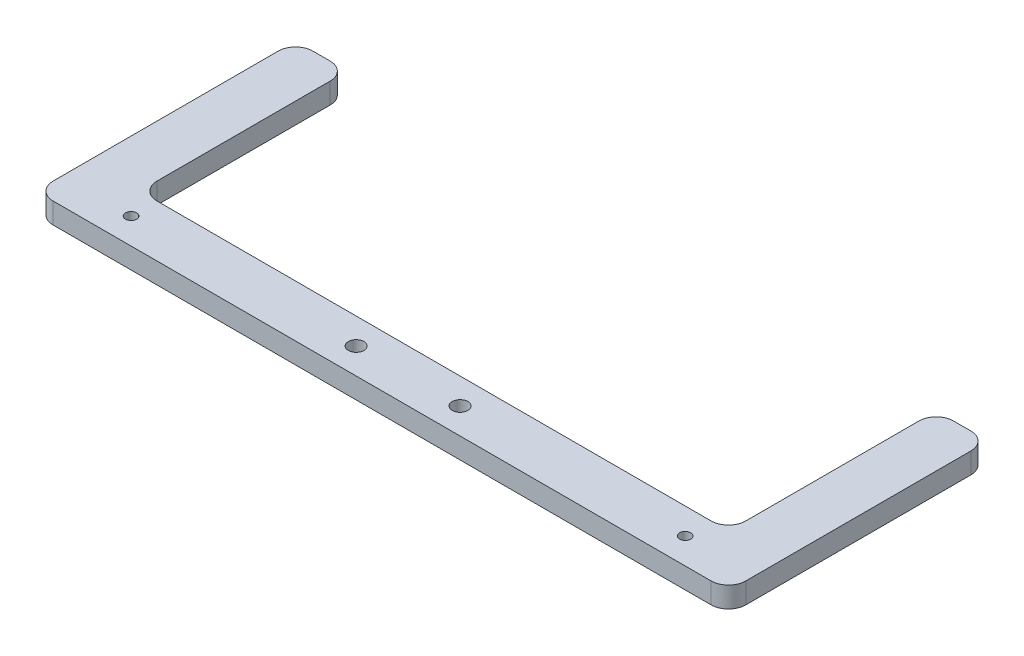
from build123d import *

# Parameters (mm, degrees)
BOSS_EXTRUDE1_DEPTH  = 6
FILLET1_R            = 5
SKETCH2_R            = 2.25
SKETCH2_R_2          = 1.6
CUT_EXTRUDE1_DEPTH   = 117.773284616
FILLET1_OF_MIRROR1_R = 5


with BuildPart() as part:
    # Sketch1 → Boss-Extrude1 (new body)
    with BuildSketch(Plane(origin=(0, 0, 0), x_dir=(1, 0, 0), z_dir=(0, 1, 0))):
        Polygon((0, 0), (-85, 0), (-85, 60), (-100, 60), (-100, -15), (0, -15), align=None)
    boss_extrude1 = extrude(amount=BOSS_EXTRUDE1_DEPTH)

    # Fillet1
    fillet1_edges = [part.edges().sort_by_distance(p)[0] for p in [
        (-100, 3, 15),
        (-100, 3, -60),
        (-85, 3, -60),
        (-85, 3, 0),
    ]]
    fillet(fillet1_edges, radius=FILLET1_R)

    # Sketch2 → Cut-Extrude1 (cut, through all)
    with BuildSketch(Plane(origin=(0, 6, 0), x_dir=(1, 0, 0), z_dir=(0, 1, 0))):
        with Locations(Location((-15, -7.5, 0), (0, 0, 270))):
            Circle(SKETCH2_R)
        with Locations(Location((-80, -7.5, 0), (0, 0, 270))):
            Circle(SKETCH2_R_2)
    cut_extrude1 = extrude(amount=-CUT_EXTRUDE1_DEPTH, mode=Mode.SUBTRACT)

    # Mirror1: Boss-Extrude1, Cut-Extrude1 across plane
    add(boss_extrude1.mirror(Plane(origin=(0, 0, 0), x_dir=(0, 0, 1), z_dir=(1, 0, 0))))
    add(cut_extrude1.mirror(Plane(origin=(0, 0, 0), x_dir=(0, 0, 1), z_dir=(1, 0, 0))), mode=Mode.SUBTRACT)

    # Fillet1 of Mirror1
    fillet1_of_mirror1_edges = [part.edges().sort_by_distance(p)[0] for p in [
        (100, 3, 15),
        (100, 3, -60),
        (85, 3, -60),
        (85, 3, 0),
    ]]
    fillet(fillet1_of_mirror1_edges, radius=FILLET1_OF_MIRROR1_R)


solid = part.part
